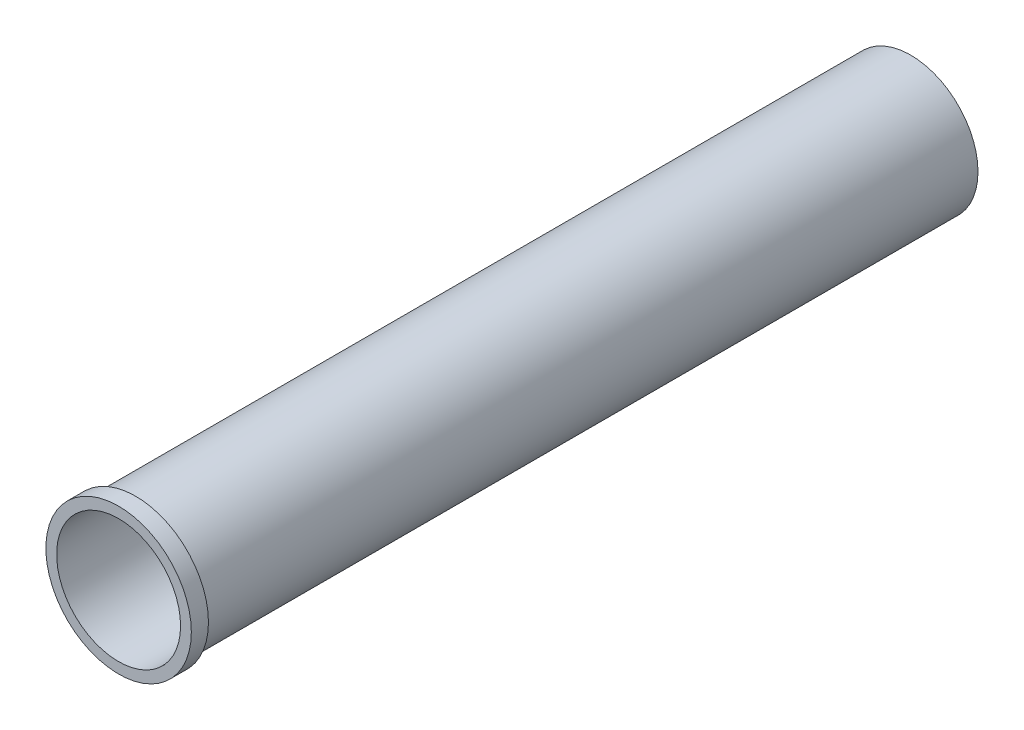
from build123d import *

# Parameters (mm, degrees)
SKETCH1_R           = 25
SKETCH1_R_2         = 23
BOSS_EXTRUDE1_DEPTH = 147
SKETCH2_R           = 27
SKETCH2_R_2         = 25
BOSS_EXTRUDE2_DEPTH = 6.35


with BuildPart() as part:
    # Sketch1 → Boss-Extrude1 (new, symmetric)
    with BuildSketch(Plane.XY):
        Circle(SKETCH1_R)
        Circle(SKETCH1_R_2, mode=Mode.SUBTRACT)
    extrude(amount=BOSS_EXTRUDE1_DEPTH, both=True)

    # Sketch2 → Boss-Extrude2 (add)
    with BuildSketch(Plane.XY.offset(147)):
        Circle(SKETCH2_R)
        Circle(SKETCH2_R_2, mode=Mode.SUBTRACT)
    extrude(amount=-BOSS_EXTRUDE2_DEPTH)


solid = part.part
